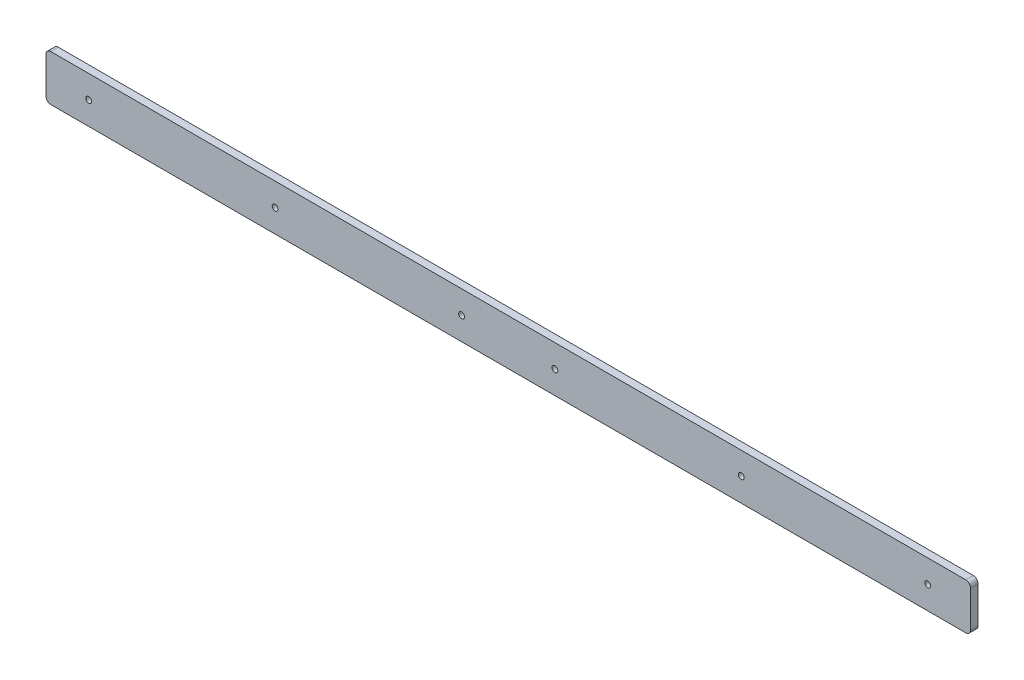
from build123d import *

# Parameters (mm, degrees)
SKETCH1_W           = 196.457160044
SKETCH1_H           = 9.757695242
BOSS_EXTRUDE1_DEPTH = 1.6002
SKETCH2_R           = 0.625
SKETCH2_R_2         = 0.62500002
CUT_EXTRUDE1_DEPTH  = 197.70584381
FILLET1_R           = 1


with BuildPart() as part:
    # Sketch1 → Boss-Extrude1 (new body)
    with BuildSketch(Plane.XY):
        with Locations((98.228580022, 4.878847621)):
            Rectangle(SKETCH1_W, SKETCH1_H)
    extrude(amount=BOSS_EXTRUDE1_DEPTH)

    # Sketch2 → Cut-Extrude1 (cut, through all)
    with BuildSketch(Plane.XY.offset(1.6002)):
        with Locations((9.074999884, 4.878847621)):
            Circle(SKETCH2_R)
        with Locations((48.698999884, 4.878847621)):
            Circle(SKETCH2_R)
        with Locations((88.323000138, 4.878847621)):
            Circle(SKETCH2_R)
        with Locations((187.38216016, 4.878847621)):
            Circle(SKETCH2_R_2)
        with Locations((147.75816016, 5.002536516)):
            Circle(SKETCH2_R_2)
        with Locations((108.13416016, 4.878847621)):
            Circle(SKETCH2_R_2)
    extrude(amount=-CUT_EXTRUDE1_DEPTH, mode=Mode.SUBTRACT)

    # Fillet1
    fillet1_edges = [part.edges().sort_by_distance(p)[0] for p in [
        (0, 0, 0.8001),
        (196.457160044, 0, 0.8001),
        (196.457160044, 9.757695242, 0.8001),
        (0, 9.757695242, 0.8001),
    ]]
    fillet(fillet1_edges, radius=FILLET1_R)


solid = part.part
